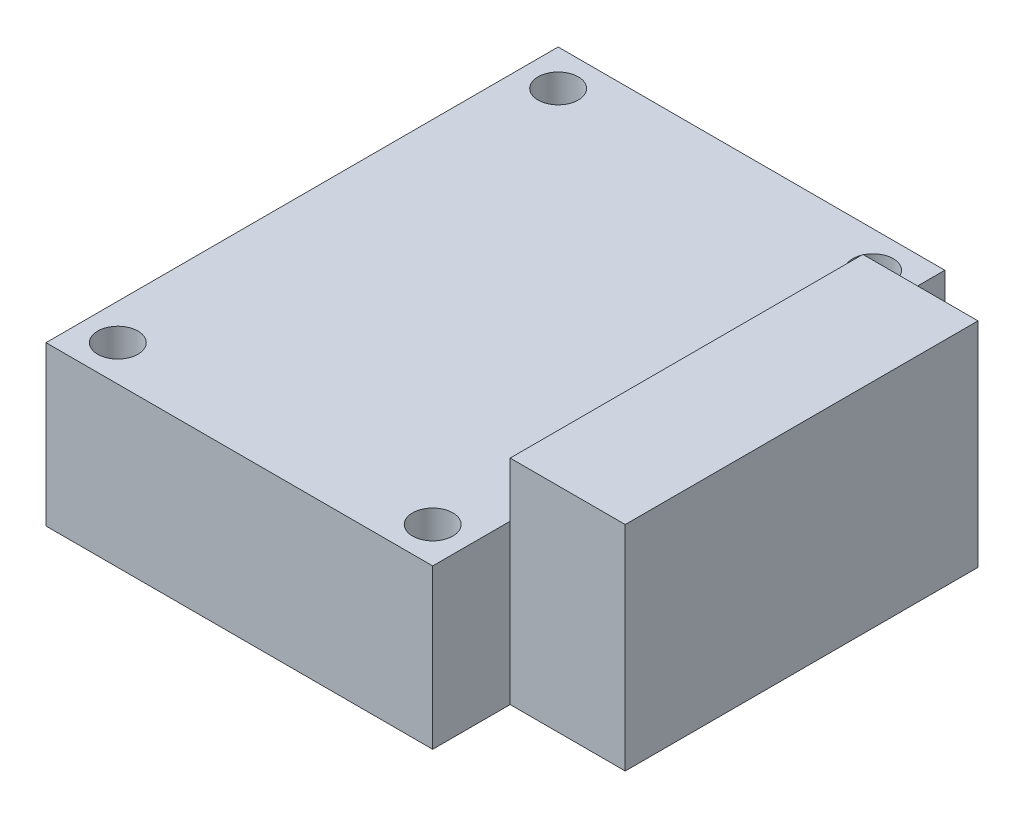
from build123d import *

# Parameters (mm, degrees)
SKETCH1_W           = 33.6
SKETCH1_H           = 44.5
SKETCH1_R           = 1.75
BOSS_EXTRUDE1_DEPTH = 13.8
SKETCH2_W           = 30.65
SKETCH2_H           = 8.55
BOSS_EXTRUDE2_DEPTH = 10
SKETCH3_W           = 10
SKETCH3_H           = 30.65
BOSS_EXTRUDE3_DEPTH = 10


with BuildPart() as part:
    # Sketch1 → Boss-Extrude1 (new body)
    with BuildSketch(Plane(origin=(0, 0, 0), x_dir=(1, 0, 0), z_dir=(0, 1, 0))):
        Rectangle(SKETCH1_W, SKETCH1_H)
        with Locations(Location((-13.68, 19.13, 0), (0, 0, 90))):
            Circle(SKETCH1_R, mode=Mode.SUBTRACT)
        with Locations(Location((-13.68, -19.13, 0), (0, 0, 90))):
            Circle(SKETCH1_R, mode=Mode.SUBTRACT)
        with Locations(Location((13.68, -19.13, 0), (0, 0, 90))):
            Circle(SKETCH1_R, mode=Mode.SUBTRACT)
        with Locations(Location((13.68, 19.13, 0), (0, 0, 90))):
            Circle(SKETCH1_R, mode=Mode.SUBTRACT)
    extrude(amount=BOSS_EXTRUDE1_DEPTH)

    # Sketch2 → Boss-Extrude2 (add)
    with BuildSketch(Plane(origin=(16.8, 0, 0), x_dir=(0, 0, -1), z_dir=(1, 0, 0))):
        with Locations((-0.195, 4.275)):
            Rectangle(SKETCH2_W, SKETCH2_H)
    extrude(amount=BOSS_EXTRUDE2_DEPTH)

    # Sketch3 → Boss-Extrude3 (add)
    with BuildSketch(Plane(origin=(0, 8.55, 0), x_dir=(1, 0, 0), z_dir=(0, 1, 0))):
        with Locations((21.8, -0.195)):
            Rectangle(SKETCH3_W, SKETCH3_H)
    extrude(amount=BOSS_EXTRUDE3_DEPTH)


solid = part.part
